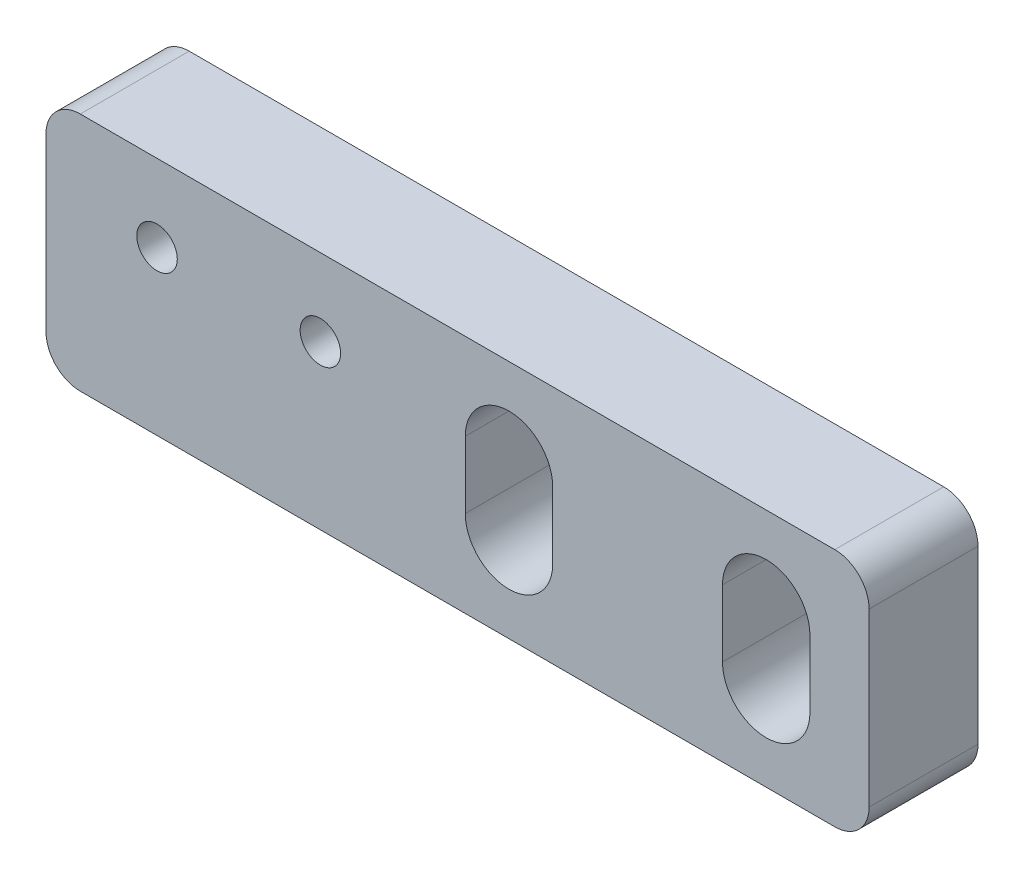
from build123d import *

# Parameters (mm, degrees)
SKETCH1_R           = 1.181
BOSS_EXTRUDE1_DEPTH = 6.35
SKETCH1_3_R         = 2.286
SKETCH1_3_R_2       = 1.181
CUT_EXTRUDE1_DEPTH  = 3.175


with BuildPart() as part:
    # Sketch1 → Boss-Extrude1 (new body)
    with BuildSketch(Plane.XY):
        with BuildLine():
            ThreePointArc((397.033701588, 241.383854224), (397.619488025, 239.969640661), (399.033701588, 239.383854223))
            Line((399.033701588, 239.383854223), (443.033701589, 239.383854223))
            ThreePointArc((443.033701589, 239.383854223), (444.447915151, 239.969640661), (445.033701588, 241.383854223))
            Line((445.033701588, 241.383854223), (445.033701588, 251.383854223))
            ThreePointArc((445.033701588, 251.383854223), (444.447915152, 252.798067786), (443.033701589, 253.383854224))
            Line((443.033701589, 253.383854224), (399.033701588, 253.383854224))
            ThreePointArc((399.033701588, 253.383854224), (397.619488025, 252.798067787), (397.033701588, 251.383854224))
            Line((397.033701588, 251.383854224), (397.033701588, 241.383854224))
        make_face()
        with BuildLine():
            Line((421.483701588, 244.433854222), (421.483701588, 248.333854223))
            ThreePointArc((421.483701588, 248.333854223), (424.033701588, 250.883854223), (426.583701588, 248.333854223))
            Line((426.583701588, 248.333854223), (426.583701588, 244.433854222))
            ThreePointArc((426.583701588, 244.433854222), (424.033701588, 241.883854222), (421.483701588, 244.433854222))
        make_face(mode=Mode.SUBTRACT)
        with BuildLine():
            Line((436.483701588, 244.433854222), (436.483701588, 248.333854223))
            ThreePointArc((436.483701588, 248.333854223), (439.033701588, 250.883854223), (441.583701588, 248.333854223))
            Line((441.583701588, 248.333854223), (441.583701588, 244.433854222))
            ThreePointArc((441.583701588, 244.433854222), (439.033701588, 241.883854222), (436.483701588, 244.433854222))
        make_face(mode=Mode.SUBTRACT)
        with Locations((403.508701589, 248.883854223)):
            Circle(SKETCH1_R, mode=Mode.SUBTRACT)
        with Locations((413.033701589, 248.883854223)):
            Circle(SKETCH1_R, mode=Mode.SUBTRACT)
    extrude(amount=BOSS_EXTRUDE1_DEPTH)

    # Sketch1<3> → Cut-Extrude1 (cut)
    # profile 1 of 2: a face of its own
    with BuildSketch(Plane.XY):
        with Locations((403.508701589, 248.883854223)):
            Circle(SKETCH1_3_R)
        with Locations((403.508701589, 248.883854223)):
            Circle(SKETCH1_3_R_2, mode=Mode.SUBTRACT)
    # profile 2 of 2: a face of its own
    with BuildSketch(Plane.XY):
        with Locations((413.033701589, 248.883854223)):
            Circle(SKETCH1_3_R)
        with Locations((413.033701589, 248.883854223)):
            Circle(SKETCH1_3_R_2, mode=Mode.SUBTRACT)
    extrude(amount=CUT_EXTRUDE1_DEPTH, mode=Mode.SUBTRACT)


solid = part.part
